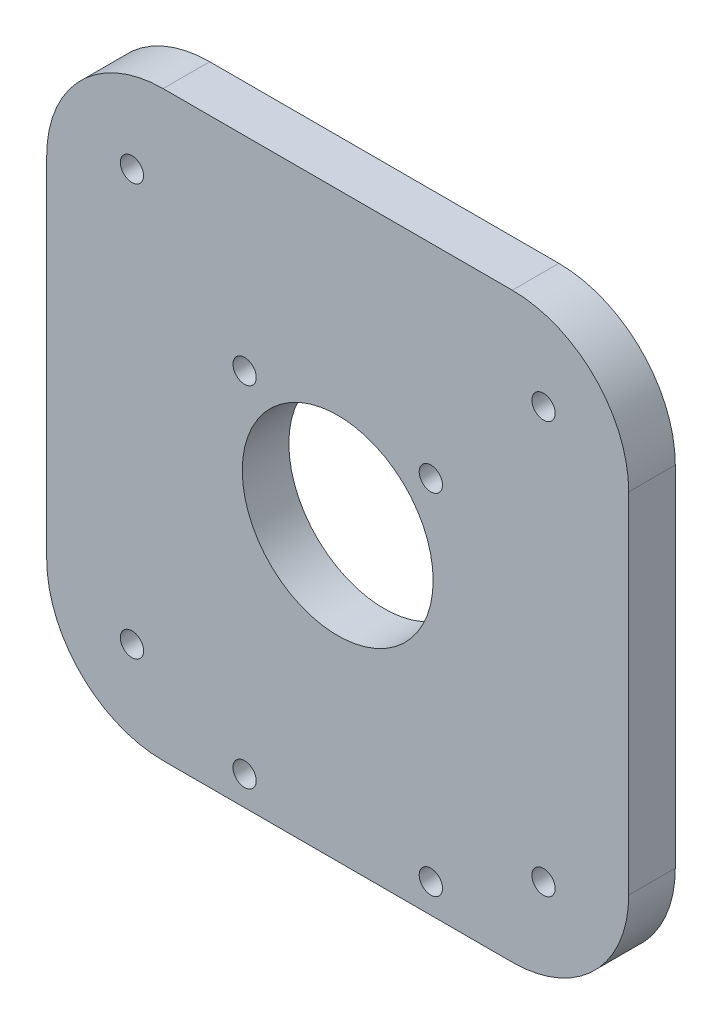
from build123d import *

# Parameters (mm, degrees)
SKETCH1_W           = 50
SKETCH1_H           = 50
BOSS_EXTRUDE1_DEPTH = 4
SKETCH2_R           = 8.2
SKETCH2_R_2         = 1
CUT_EXTRUDE1_DEPTH  = 10
SKETCH3_R           = 1
CUT_EXTRUDE2_DEPTH  = 4
FILLET1_R           = 10


with BuildPart() as part:
    # Sketch1 → Boss-Extrude1 (new body)
    with BuildSketch(Plane.XY):
        Rectangle(SKETCH1_W, SKETCH1_H)
    extrude(amount=BOSS_EXTRUDE1_DEPTH)

    # Sketch2 → Cut-Extrude1 (cut)
    with BuildSketch(Plane.XY.offset(4)):
        Circle(SKETCH2_R)
        with Locations((-8, 7.5)):
            Circle(SKETCH2_R_2)
        with Locations((8, 7.5)):
            Circle(SKETCH2_R_2)
        with Locations((-8, -22.5)):
            Circle(SKETCH2_R_2)
        with Locations((8, -22.5)):
            Circle(SKETCH2_R_2)
    extrude(amount=-CUT_EXTRUDE1_DEPTH, mode=Mode.SUBTRACT)

    # Sketch3 → Cut-Extrude2 (cut)
    with BuildSketch(Plane.XY.offset(4)):
        with Locations((-17.67766953, 17.67766953)):
            Circle(SKETCH3_R)
        with Locations((17.67766953, 17.67766953)):
            Circle(SKETCH3_R)
        with Locations((17.67766953, -17.67766953)):
            Circle(SKETCH3_R)
        with Locations((-17.67766953, -17.67766953)):
            Circle(SKETCH3_R)
    extrude(amount=-CUT_EXTRUDE2_DEPTH, mode=Mode.SUBTRACT)

    # Fillet1
    fillet1_edges = [part.edges().sort_by_distance(p)[0] for p in [
        (25, -25, 2),
        (-25, -25, 2),
        (-25, 25, 2),
        (25, 25, 2),
    ]]
    fillet(fillet1_edges, radius=FILLET1_R)


solid = part.part
